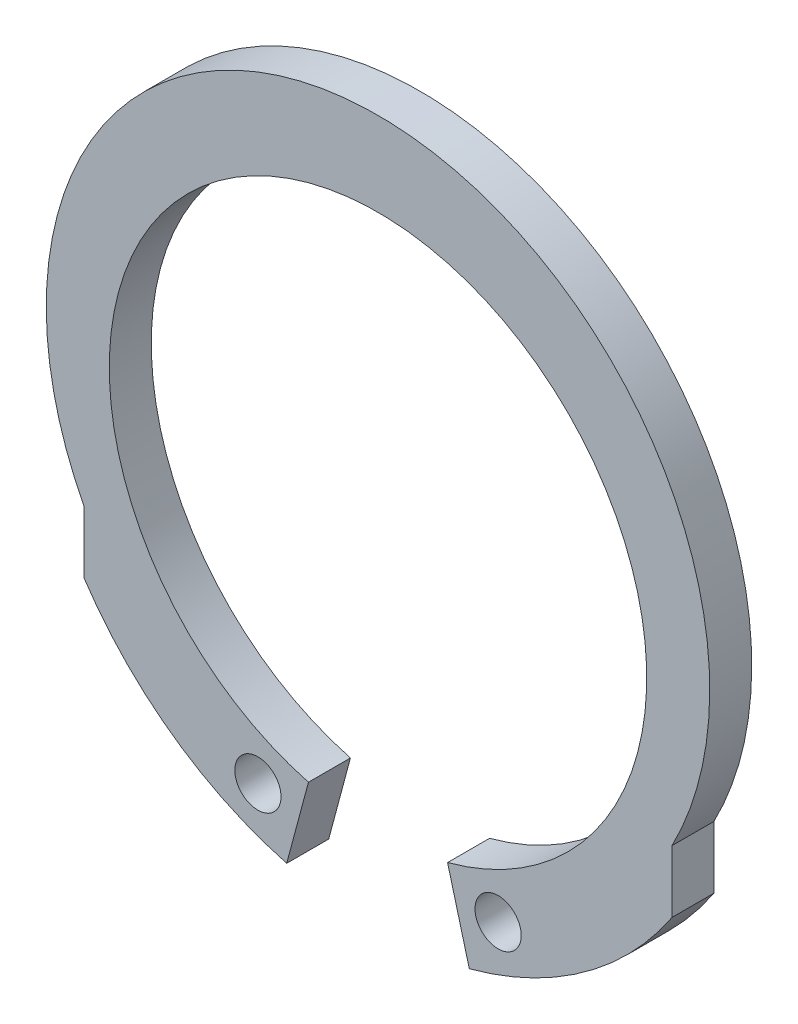
from build123d import *

# Parameters (mm, degrees)
SKETCH1_R      = 0.55
EXTRUDE1_DEPTH = 1


with BuildPart() as part:
    # Sketch1 → Extrude1 (new body)
    with BuildSketch(Plane.XY):
        with BuildLine():
            Line((1.656441889, -6.181925288), (2.174079979, -8.113776941))
            ThreePointArc((2.174079979, -8.113776941), (4.904287135, -6.819675043), (7, -4.643274706))
            Line((7, -4.643274706), (7, -3.161966685))
            ThreePointArc((7, -3.161966685), (0, 8.4), (-7, -3.161966685))
            Line((-7, -3.161966685), (-7, -4.643274706))
            ThreePointArc((-7, -4.643274706), (-4.904287135, -6.819675043), (-2.174079979, -8.113776941))
            Line((-2.174079979, -8.113776941), (-1.656441889, -6.181925288))
            ThreePointArc((-1.656441889, -6.181925288), (0, 6.4), (1.656441889, -6.181925288))
        make_face()
        with Locations((-2.86, -6.809962004)):
            Circle(SKETCH1_R, mode=Mode.SUBTRACT)
        with Locations(Location((2.86, -6.809962004, 0), (0, 0, 180))):
            Circle(SKETCH1_R, mode=Mode.SUBTRACT)
    extrude(amount=EXTRUDE1_DEPTH)


solid = part.part
